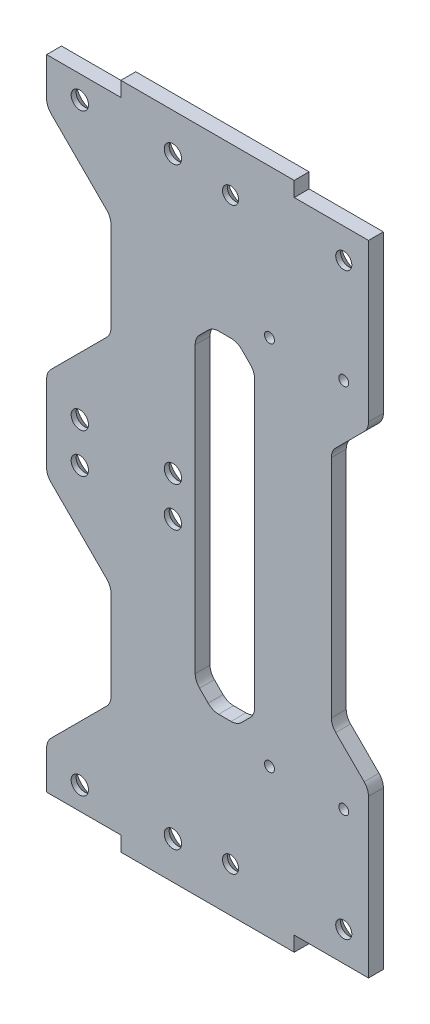
from build123d import *

# Parameters (mm, degrees)
SKETCH_1_W          = 65
SKETCH_1_H          = 129
SKETCH_1_W_2        = 35
SKETCH_1_H_2        = 6
EXTRUDE_1_DEPTH     = 3
SKETCH_2_R          = 1.75
CUT_EXTRUDE_1_DEPTH = 10
CHAMFER_1_SIZE      = 2
SKETCH_3_R          = 1
CUT_EXTRUDE_2_DEPTH = 10
CHAMFER_2_SIZE      = 1.5
CUT_EXTRUDE_3_DEPTH = 10
FILLET_1_R          = 3
CUT_EXTRUDE_4_DEPTH = 22
FILLET_2_R          = 3
SKETCH_6_R          = 1.625
CUT_EXTRUDE_5_DEPTH = 22
CHAMFER_3_SIZE      = 2
CUT_EXTRUDE_6_DEPTH = 22
FILLET_3_R          = 3


with BuildPart() as part:
    # Эскиз1 → Бобышка-Вытянуть1 (new body)
    with BuildSketch(Plane.XY):
        Rectangle(SKETCH_1_W, SKETCH_1_H)
        with Locations((0, 64.5)):
            Rectangle(SKETCH_1_W_2, SKETCH_1_H_2)
        with Locations((0, -64.5)):
            Rectangle(SKETCH_1_W_2, SKETCH_1_H_2)
    extrude(amount=EXTRUDE_1_DEPTH)

    # Эскиз2 → Вырез-Вытянуть1 (cut)
    with BuildSketch(Plane.XY.offset(3)):
        with Locations((-25.8, 59.9)):
            Circle(SKETCH_2_R)
        with Locations((-7, 59.9)):
            Circle(SKETCH_2_R)
        with Locations((-25.8, 4)):
            Circle(SKETCH_2_R)
        with Locations((-7, 4)):
            Circle(SKETCH_2_R)
        with Locations((-7, -4)):
            Circle(SKETCH_2_R)
        with Locations((-25.8, -4)):
            Circle(SKETCH_2_R)
        with Locations((-7, -59.9)):
            Circle(SKETCH_2_R)
        with Locations((-25.8, -59.9)):
            Circle(SKETCH_2_R)
    extrude(amount=-CUT_EXTRUDE_1_DEPTH, mode=Mode.SUBTRACT)

    # Фаска1
    chamfer_1_edges = [part.edges().sort_by_distance(p)[0] for p in [
        (-8.75, 4, 0),
        (-27.55, 4, 0),
        (-8.75, -4, 0),
        (-8.75, 59.9, 0),
        (-27.55, -59.9, 0),
        (-8.75, -59.9, 0),
        (-27.55, -4, 0),
        (-27.55, 59.9, 0),
    ]]
    chamfer(chamfer_1_edges, length=CHAMFER_1_SIZE)

    # Эскиз3 → Вырез-Вытянуть2 (cut)
    with BuildSketch(Plane(origin=(0, 0, 0), x_dir=(-1, 0, 0), z_dir=(0, 0, -1))):
        with Locations((-27.5, 37.5)):
            Circle(SKETCH_3_R)
        with Locations((-12.5, 37.5)):
            Circle(SKETCH_3_R)
        with Locations((-27.5, -37.5)):
            Circle(SKETCH_3_R)
        with Locations((-12.5, -37.5)):
            Circle(SKETCH_3_R)
    extrude(amount=-CUT_EXTRUDE_2_DEPTH, mode=Mode.SUBTRACT)

    # Фаска2
    chamfer_2_edges = [part.edges().sort_by_distance(p)[0] for p in [
        (13.5, 37.5, 0),
        (28.5, -37.5, 0),
        (13.5, -37.5, 0),
        (28.5, 37.5, 0),
    ]]
    chamfer(chamfer_2_edges, length=CHAMFER_2_SIZE)

    # Эскиз4 → Вырез-Вытянуть3 (cut)
    with BuildSketch(Plane(origin=(0, 0, 0), x_dir=(-1, 0, 0), z_dir=(0, 0, -1))):
        Polygon((32.5, 55.5), (19.5, 42.5), (19.5, 22), (32.5, 9), (37.771171481, 9), (37.771171481, 55.5), align=None)
        Polygon((37.771171481, -9), (32.5, -9), (19.5, -22), (19.5, -42.5), (32.5, -55.5), (37.771171481, -55.5), align=None)
    extrude(amount=-CUT_EXTRUDE_3_DEPTH, mode=Mode.SUBTRACT)

    # Скругление1
    fillet_1_edges = [part.edges().sort_by_distance(p)[0] for p in [
        (-32.5, 55.5, 1.5),
        (-32.5, 9, 1.5),
        (-19.5, 22, 1.5),
        (-19.5, 42.5, 1.5),
        (-32.5, -55.5, 1.5),
        (-19.5, -42.5, 1.5),
        (-19.5, -22, 1.5),
        (-32.5, -9, 1.5),
    ]]
    fillet(fillet_1_edges, radius=FILLET_1_R)

    # Эскиз5 → Вырез-Вытянуть4 (cut)
    with BuildSketch(Plane.XY.offset(3)):
        Polygon((1, 33.5), (6, 33.5), (9.5, 30), (9.5, -30), (6, -33.5), (1, -33.5), (-2.5, -30), (-2.5, 30), align=None)
    extrude(amount=-CUT_EXTRUDE_4_DEPTH, mode=Mode.SUBTRACT)

    # Скругление2
    fillet_2_edges = [part.edges().sort_by_distance(p)[0] for p in [
        (-2.5, 30, 1.5),
        (1, 33.5, 1.5),
        (6, 33.5, 1.5),
        (9.5, 30, 1.5),
        (9.5, -30, 1.5),
        (6, -33.5, 1.5),
        (1, -33.5, 1.5),
        (-2.5, -30, 1.5),
    ]]
    fillet(fillet_2_edges, radius=FILLET_2_R)

    # Эскиз6 → Вырез-Вытянуть5 (cut)
    with BuildSketch(Plane(origin=(0, 0, 0), x_dir=(-1, 0, 0), z_dir=(0, 0, -1))):
        with Locations((-27.5, 58.5)):
            Circle(SKETCH_6_R)
        with Locations((-4.64, 58.5)):
            Circle(SKETCH_6_R)
        with Locations(Location((-4.64, -58.5, 0), (0, 0, 180))):
            Circle(SKETCH_6_R)
        with Locations(Location((-27.5, -58.5, 0), (0, 0, 180))):
            Circle(SKETCH_6_R)
    extrude(amount=-CUT_EXTRUDE_5_DEPTH, mode=Mode.SUBTRACT)

    # Фаска3
    chamfer_3_edges = [part.edges().sort_by_distance(p)[0] for p in [
        (25.875, -58.5, 0),
        (3.015, -58.5, 0),
        (6.265, 58.5, 0),
        (29.125, 58.5, 0),
    ]]
    chamfer(chamfer_3_edges, length=CHAMFER_3_SIZE)

    # Эскиз7 → Вырез-Вытянуть6 (cut)
    with BuildSketch(Plane(origin=(0, 0, 0), x_dir=(-1, 0, 0), z_dir=(0, 0, -1))):
        Polygon((-32.5, 31.5), (-25, 24), (-25, -24), (-32.5, -31.5), (-45.278414839, -31.5), (-45.278414839, 31.5), align=None)
    extrude(amount=-CUT_EXTRUDE_6_DEPTH, mode=Mode.SUBTRACT)

    # Скругление3
    fillet_3_edges = [part.edges().sort_by_distance(p)[0] for p in [
        (32.5, 31.5, 1.5),
        (25, 24, 1.5),
        (25, -24, 1.5),
        (32.5, -31.5, 1.5),
    ]]
    fillet(fillet_3_edges, radius=FILLET_3_R)


solid = part.part
